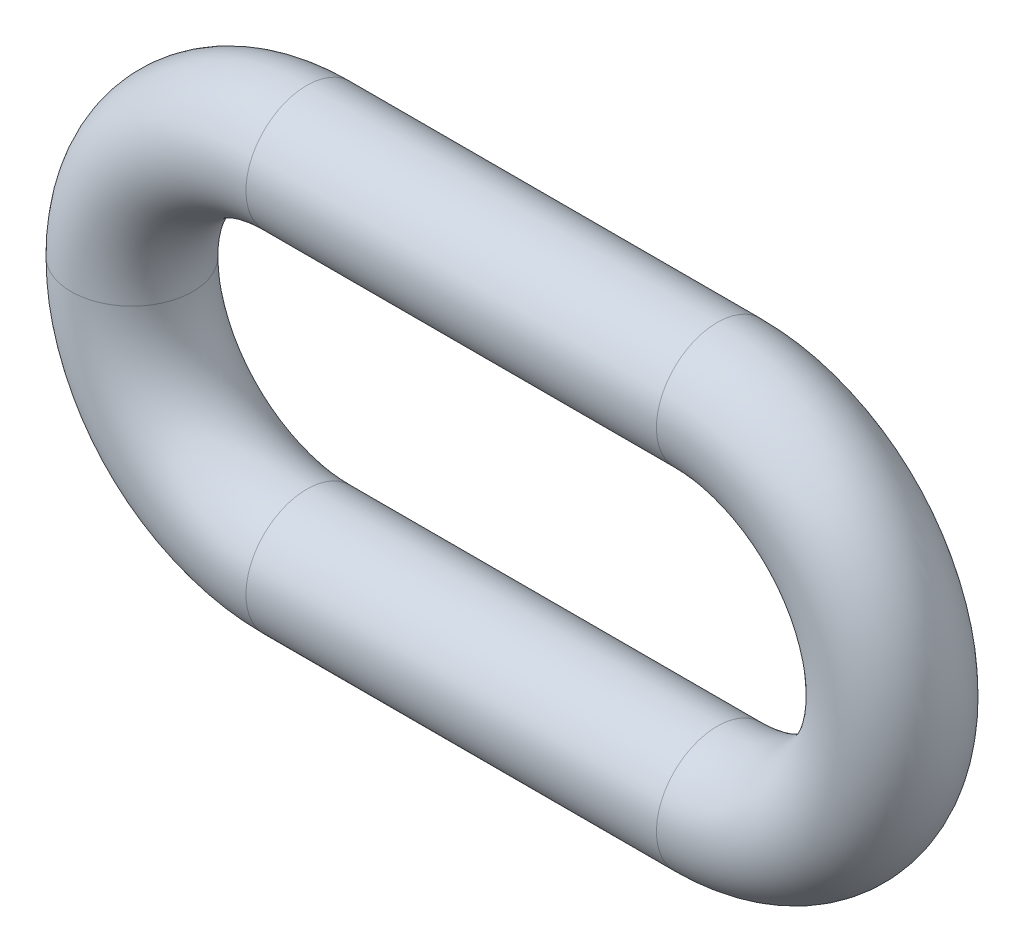
from build123d import *

# Parameters (mm, degrees)
SKETCH_2_R = 2


with BuildPart() as part:
    # По траектории1: sweep along a path in Эскиз1
    with BuildLine(Plane.XY) as sweep_1_path:
        Line((19.25, -5.75), (5.75, -5.75))
        ThreePointArc((5.75, -5.75), (0, 0), (5.75, 5.75))
        Line((5.75, 5.75), (19.25, 5.75))
        ThreePointArc((19.25, 5.75), (25, 0), (19.25, -5.75))
    # Эскиз2 → По траектории1 (sweep)
    with BuildSketch(Plane(origin=(0, 0, 0), x_dir=(1, 0, 0), z_dir=(0, 1, 0))):
        Circle(SKETCH_2_R)
    sweep(path=sweep_1_path.line)


solid = part.part
